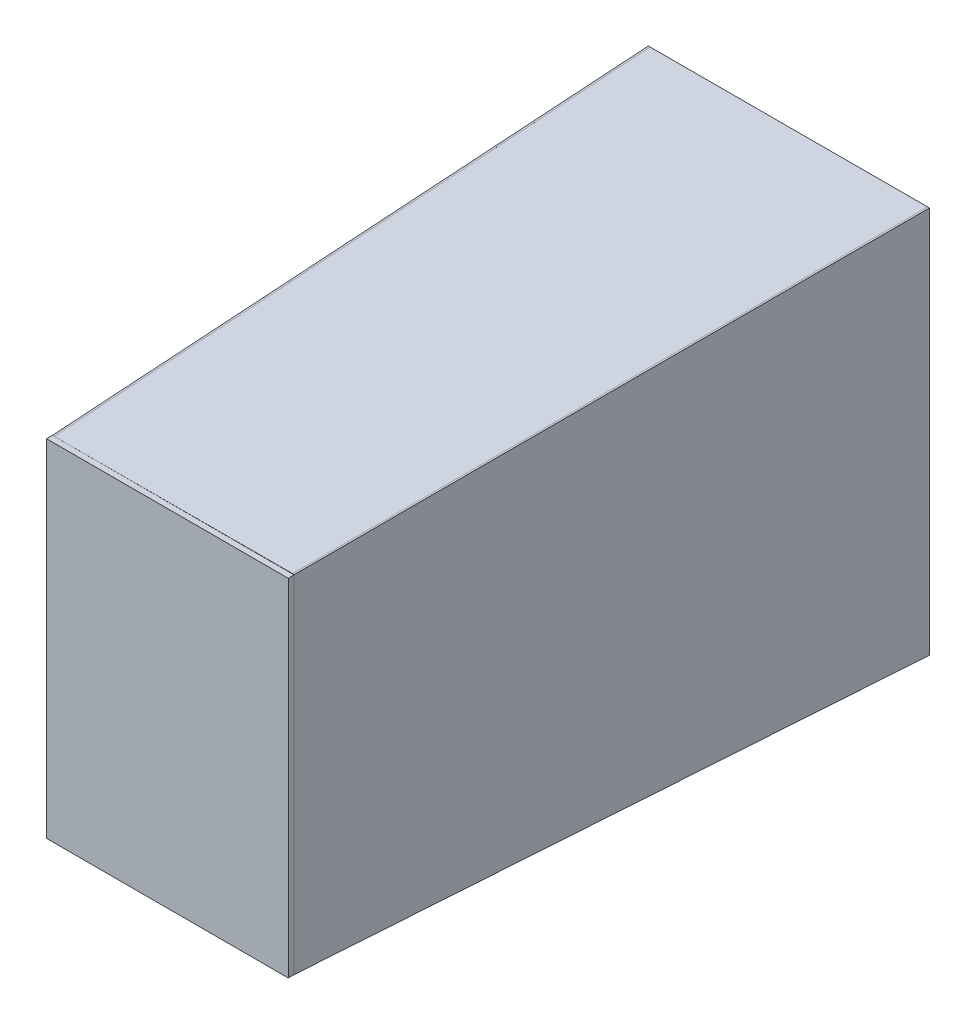
from build123d import *

# Parameters (mm, degrees)
BOSS_EXTRUDE1_DEPTH = 339.725
BOSS_EXTRUDE2_REACH = 691.724
CUT_EXTRUDE4_DEPTH  = 697.975102984
SKETCH6_W           = 376.513172643
SKETCH6_H           = 53.606624692
CUT_EXTRUDE8_DEPTH  = 692.004787475
SKETCH7_W           = 213.060365226
SKETCH7_H           = 305.038721392
BOSS_EXTRUDE4_DEPTH = 5.842


with BuildPart() as part:
    # Sketch1 → Boss-Extrude1 (new body)
    with BuildSketch(Plane(origin=(0, 0, 0), x_dir=(1, 0, 0), z_dir=(0, 1, 0))):
        Polygon((0, 0), (209.55, 0), (227.063263081, 547.6875), (228.651574493, 547.6875), (211.08754833, -1.5875), (-1.53754833, -1.5875), (-19.101574493, 547.6875), (-17.513263081, 547.6875), align=None)
    extrude(amount=-BOSS_EXTRUDE1_DEPTH)

    # Boss-Extrude2: up to this plane
    boss_extrude2_end = Plane(origin=(-19.101574493, -339.725, -547.6875), z_dir=(-0.9994891356560206, 0, 0.03196040840760531))
    # Sketch3 → Boss-Extrude2 (add, up to the surface)
    with BuildSketch(Plane(origin=(210.922640445, 0, 6.744619317), x_dir=(0.031960408407605376, 0, -0.9994891356560207), z_dir=(0.9994891356560207, 0, 0.031960408407605376)), mode=Mode.PRIVATE) as boss_extrude2_sk1:
        Polygon((5.20194578, -17.461159368), (554.715503688, 0), (554.715503688, -1.588301242), (5.210173674, -19.049199163), align=None)
    boss_extrude2_tool1 = split(extrude(boss_extrude2_sk1.sketch, amount=-BOSS_EXTRUDE2_REACH, mode=Mode.PRIVATE), bisect_by=boss_extrude2_end, keep=Keep.BOTH, mode=Mode.PRIVATE)
    add(boss_extrude2_tool1.solids().sort_by_distance((219.870301, -9.524663, -273.07314))[0])
    # Sketch3 → Boss-Extrude2 (add, up to the surface)
    with BuildSketch(Plane(origin=(210.922640445, 0, 6.744619317), x_dir=(0.031960408407605376, 0, -0.9994891356560207), z_dir=(0.9994891356560207, 0, 0.031960408407605376)), mode=Mode.PRIVATE) as boss_extrude2_sk2:
        Polygon((5.159755252, -322.2625), (554.715503688, -339.725), (554.715503688, -341.313301242), (5.159755252, -323.850801242), align=None)
    boss_extrude2_tool2 = split(extrude(boss_extrude2_sk2.sketch, amount=-BOSS_EXTRUDE2_REACH, mode=Mode.PRIVATE), bisect_by=boss_extrude2_end, keep=Keep.BOTH, mode=Mode.PRIVATE)
    add(boss_extrude2_tool2.solids().sort_by_distance((219.869561, -331.787901, -273.05))[0])

    # Sketch5 → Cut-Extrude4 (cut, through all)
    with BuildSketch(Plane(origin=(210.922640445, 0, 6.744619317), x_dir=(0.031960408407605376, 0, -0.9994891356560207), z_dir=(0.9994891356560207, 0, 0.031960408407605376))):
        Polygon((5.159755252, -322.263840612), (554.715503688, -341.313301242), (-187.514814981, -341.313301242), align=None)
        Polygon((5.159755252, -17.461159388), (-85.492186458, -17.461159388), (-85.492186458, 58.963399127), (554.715503688, 0), align=None)
    extrude(amount=-CUT_EXTRUDE4_DEPTH, mode=Mode.SUBTRACT)

    # Sketch6 → Cut-Extrude8 (cut, through all)
    with BuildSketch(Plane(origin=(0, 0, 0), x_dir=(1, 0, 0), z_dir=(0, 1, 0))):
        Polygon((-1.755182613, 5.218517559), (295.768737434, 5.218517559), (295.768737434, -74.400442216), (-24.623288418, -74.400442216), align=None)
        with Locations((124.241384065, 574.490812346)):
            Rectangle(SKETCH6_W, SKETCH6_H)
    extrude(amount=-CUT_EXTRUDE8_DEPTH, mode=Mode.SUBTRACT)

    # Sketch7 → Boss-Extrude4 (add)
    with BuildSketch(Plane.XY):
        with Locations((104.775, -169.980520084)):
            Rectangle(SKETCH7_W, SKETCH7_H)
    extrude(amount=-BOSS_EXTRUDE4_DEPTH)


solid = part.part
